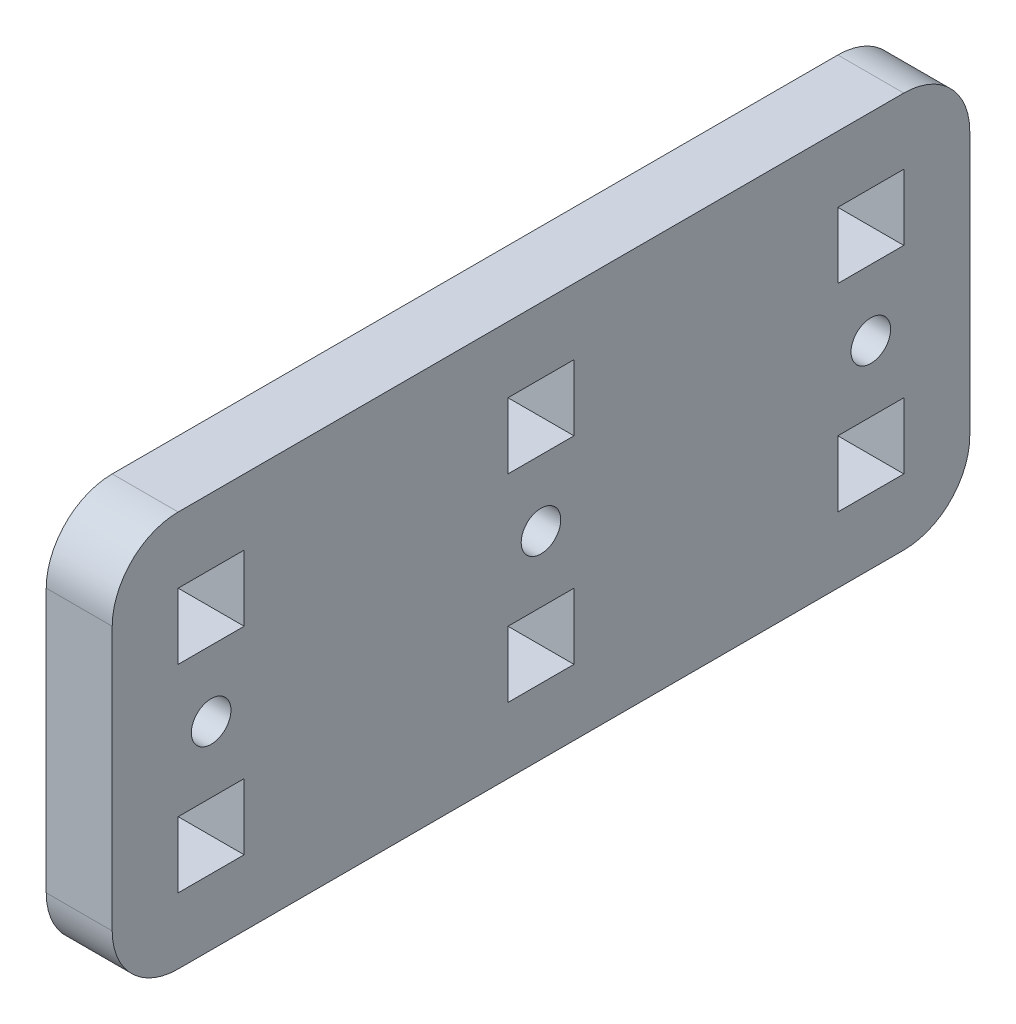
from build123d import *

# Parameters (mm, degrees)
SKETCH1_W           = 65
SKETCH1_H           = 30
SKETCH1_R           = 1.5
SKETCH1_W_2         = 5
SKETCH1_H_2         = 5
BOSS_EXTRUDE1_DEPTH = 5
FILLET1_R           = 5


with BuildPart() as part:
    # Sketch1 → Boss-Extrude1 (new body)
    with BuildSketch(Plane(origin=(0, 0, 0), x_dir=(0, 0, -1), z_dir=(1, 0, 0))):
        with Locations((32.5, 15)):
            Rectangle(SKETCH1_W, SKETCH1_H)
        with Locations((7.5, 15)):
            Circle(SKETCH1_R, mode=Mode.SUBTRACT)
        with Locations(Location((57.5, 15, 0), (0, 0, 180))):
            Circle(SKETCH1_R, mode=Mode.SUBTRACT)
        with Locations(Location((32.5, 15, 0), (0, 0, 180))):
            Circle(SKETCH1_R, mode=Mode.SUBTRACT)
        with Locations((7.5, 22.5)):
            Rectangle(SKETCH1_W_2, SKETCH1_H_2, mode=Mode.SUBTRACT)
        with Locations((7.5, 7.5)):
            Rectangle(SKETCH1_W_2, SKETCH1_H_2, mode=Mode.SUBTRACT)
        with Locations((57.5, 22.5)):
            Rectangle(SKETCH1_W_2, SKETCH1_H_2, mode=Mode.SUBTRACT)
        with Locations((57.5, 7.5)):
            Rectangle(SKETCH1_W_2, SKETCH1_H_2, mode=Mode.SUBTRACT)
        with Locations((32.5, 22.5)):
            Rectangle(SKETCH1_W_2, SKETCH1_H_2, mode=Mode.SUBTRACT)
        with Locations((32.5, 7.5)):
            Rectangle(SKETCH1_W_2, SKETCH1_H_2, mode=Mode.SUBTRACT)
    extrude(amount=BOSS_EXTRUDE1_DEPTH)

    # Fillet1
    fillet1_edges = [part.edges().sort_by_distance(p)[0] for p in [
        (2.5, 30, 0),
        (2.5, 30, -65),
        (2.5, 0, -65),
        (2.5, 0, 0),
    ]]
    fillet(fillet1_edges, radius=FILLET1_R)


solid = part.part
